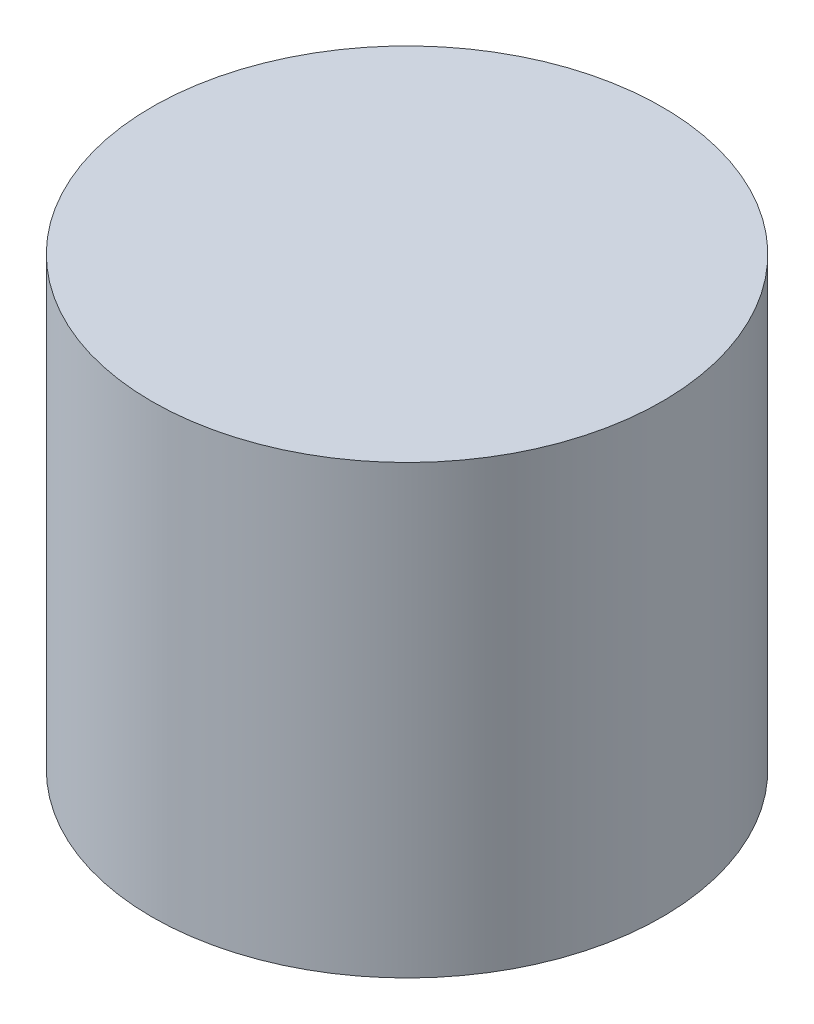
from build123d import *

# Parameters (mm, degrees)
SKETCH1_R      = 8
EXTRUDE1_DEPTH = 14


with BuildPart() as part:
    # Sketch1 → Extrude1 (new body)
    with BuildSketch(Plane(origin=(0, 0, 0), x_dir=(1, 0, 0), z_dir=(0, 1, 0))):
        with Locations(Location((0, 0, 0), (0, 0, 270))):
            Circle(SKETCH1_R)
    extrude(amount=EXTRUDE1_DEPTH)


solid = part.part
